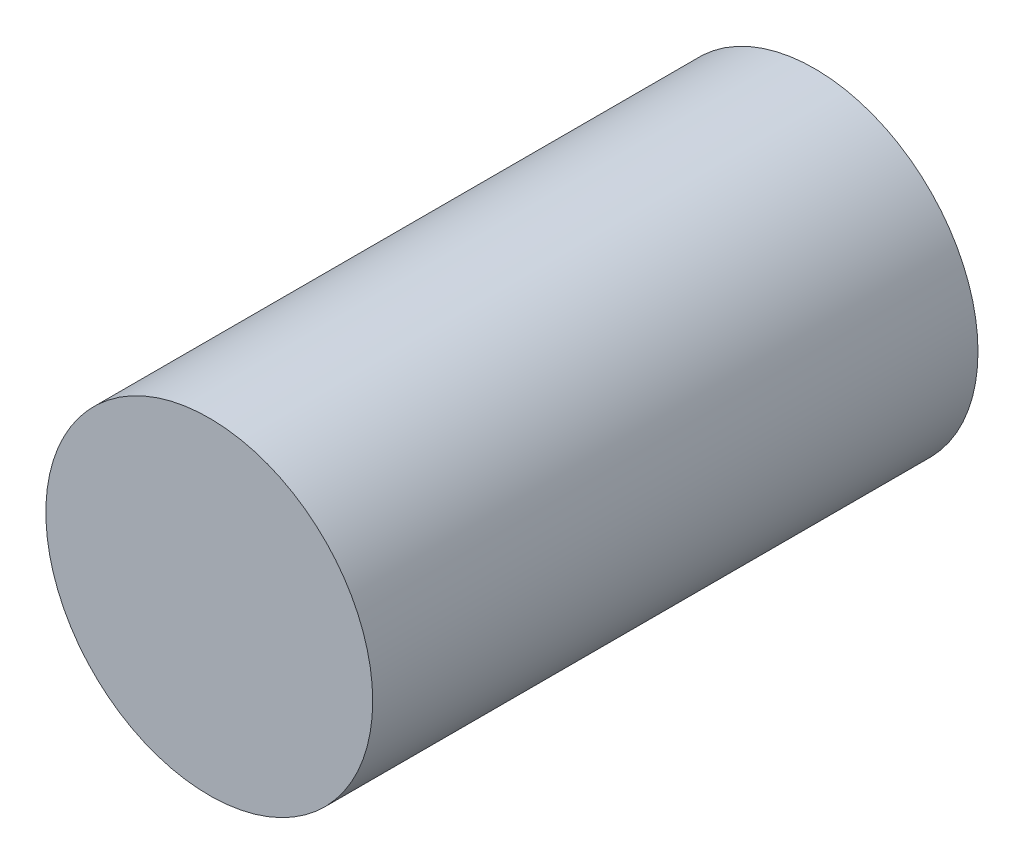
from build123d import *

# Parameters (mm, degrees)
SKETCH1_R           = 13.5
BOSS_EXTRUDE1_DEPTH = 50


with BuildPart() as part:
    # Sketch1 → Boss-Extrude1 (new body)
    with BuildSketch(Plane.XY):
        Circle(SKETCH1_R)
    extrude(amount=BOSS_EXTRUDE1_DEPTH)


solid = part.part
